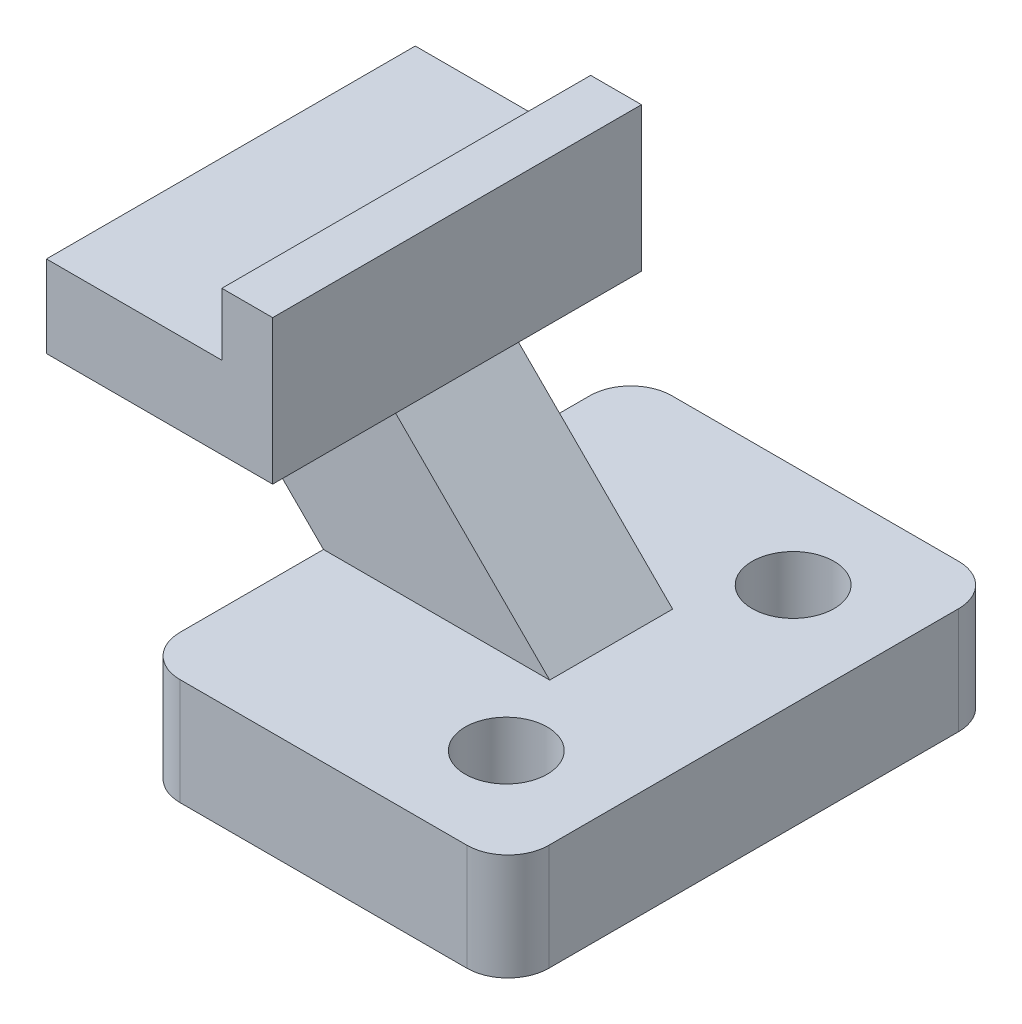
from build123d import *

# Parameters (mm, degrees)
CROQUIS1_R              = 0.25
SALIENTE_EXTRUIR2_DEPTH = 0.65
SALIENTE_EXTRUIR3_DEPTH = 0.375
SALIENTE_EXTRUIR4_DEPTH = 1.125


with BuildPart() as part:
    # Croquis1 → Saliente-Extruir2 (new body)
    with BuildSketch(Plane(origin=(0, 0, 0), x_dir=(1, 0, 0), z_dir=(0, 1, 0))):
        with BuildLine():
            Line((-0.875, 1.5), (0.875, 1.5))
            ThreePointArc((0.875, 1.5), (1.051776695, 1.426776695), (1.125, 1.25))
            Line((1.125, 1.25), (1.125, -1.25))
            ThreePointArc((1.125, -1.25), (1.051776695, -1.426776695), (0.875, -1.5))
            Line((0.875, -1.5), (-0.875, -1.5))
            ThreePointArc((-0.875, -1.5), (-1.051776695, -1.426776695), (-1.125, -1.25))
            Line((-1.125, -1.25), (-1.125, 1.25))
            ThreePointArc((-1.125, 1.25), (-1.051776695, 1.426776695), (-0.875, 1.5))
        make_face()
        with Locations(Location((0.495, 0.87, 0), (0, 0, 270))):
            Circle(CROQUIS1_R, mode=Mode.SUBTRACT)
        with Locations(Location((0.495, -0.88, 0), (0, 0, 270))):
            Circle(CROQUIS1_R, mode=Mode.SUBTRACT)
    extrude(amount=SALIENTE_EXTRUIR2_DEPTH)

    # Croquis6 → Saliente-Extruir3 (add, symmetric)
    with BuildSketch(Plane.XY):
        Polygon((-1.125, 0.65), (-2.065, 1.59), (-2.065, 2.09), (-0.995, 2.09), (-0.995, 2.47), (-0.685, 2.47), (-0.685, 1.59), (0.255, 0.65), align=None)
    extrude(amount=SALIENTE_EXTRUIR3_DEPTH, both=True)

    # Croquis7 → Saliente-Extruir4 (add, symmetric)
    with BuildSketch(Plane.XY):
        Polygon((-2.065, 1.59), (-0.685, 1.59), (-0.685, 2.47), (-0.995, 2.47), (-0.995, 2.09), (-2.065, 2.09), align=None)
    extrude(amount=SALIENTE_EXTRUIR4_DEPTH, both=True)


solid = part.part
